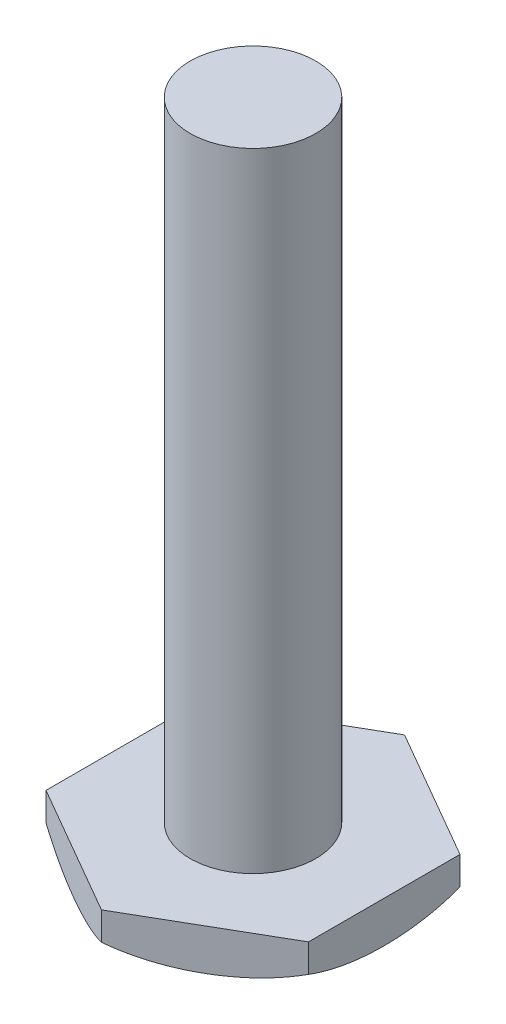
from build123d import *

# Parameters (mm, degrees)
SKETCH2_OUTSIDE_W  = 48.751
SKETCH2_OUTSIDE_H  = 48.752
CUT_EXTRUDE1_DEPTH = 79.163904494


with BuildPart() as part:
    # Sketch1 → Revolve1 (revolve)
    with BuildSketch(Plane.XY):
        with BuildLine():
            Line((13.945442694, -14.186787019), (13.945442694, -1.101180597))
            Line((13.945442694, -1.101180597), (13.945442694, 49.313212981))
            Line((13.945442694, 49.313212981), (20.295442694, 49.313212981))
            Line((20.295442694, 49.313212981), (20.295442694, -18.555587019))
            Line((20.295442694, -18.555587019), (7.413252884, -18.555587019))
            ThreePointArc((7.413252884, -18.555587019), (6.158112274, -17.849568811), (4.972892694, -17.031587019))
            Line((4.972892694, -17.031587019), (4.972892694, -14.186787019))
            Line((4.972892694, -14.186787019), (13.945442694, -14.186787019))
        make_face()
    revolve(axis=Axis((20.295442694, 49.313212981, 0), (0, -1, 0)))

    # Sketch2 outside → Cut-Extrude1 (cut, through all)
    with BuildSketch(Plane.XZ.offset(18.555587019)):
        with Locations((20.2955, 0)):
            Rectangle(SKETCH2_OUTSIDE_W, SKETCH2_OUTSIDE_H)
        Polygon((20.295442694, 15.322011053), (7.026191885, 7.661005527), (7.026191885, -7.661005527), (20.295442694, -15.322011053), (33.564693504, -7.661005527), (33.564693504, 7.661005527), align=None, mode=Mode.SUBTRACT)
    extrude(amount=-CUT_EXTRUDE1_DEPTH, mode=Mode.SUBTRACT)


solid = part.part
